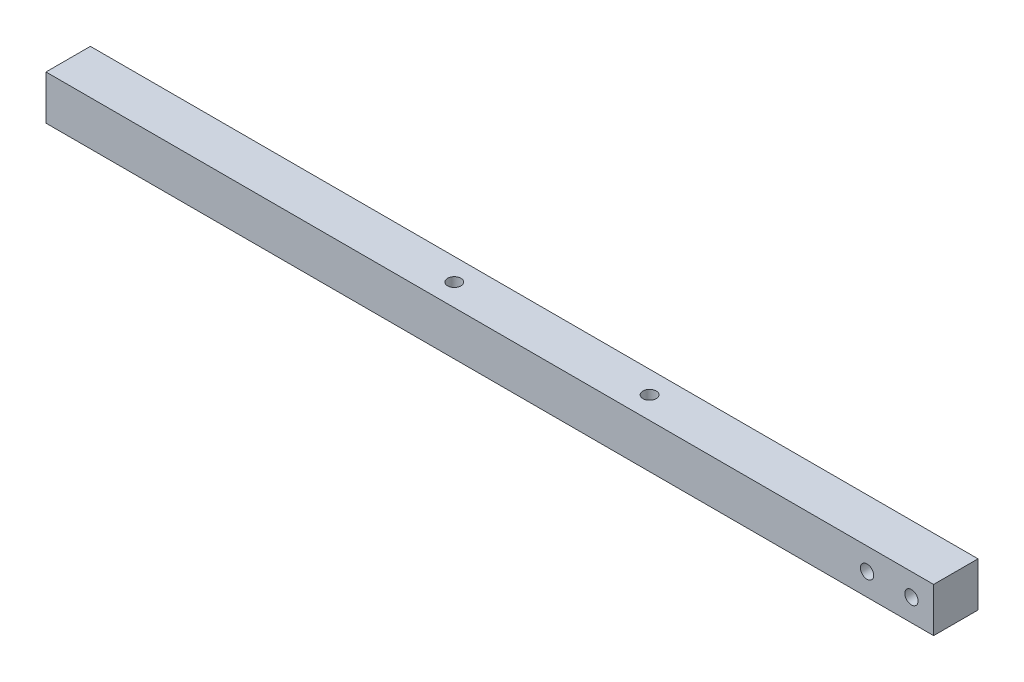
from build123d import *

# Parameters (mm, degrees)
SKIZZE1_W                       = 20
SKIZZE1_H                       = 20
AUFSATZ_LINEAR_AUSTRAGEN1_DEPTH = 400
SKIZZE2_R                       = 3
SCHNITT_LINEAR_AUSTRAGEN1_DEPTH = 401.62451248
SKETCH1_R                       = 3
EXTRUDE1_DEPTH                  = 401.62451248


with BuildPart() as part:
    # Skizze1 → Aufsatz-Linear austragen1 (new body)
    with BuildSketch(Plane(origin=(0, 0, 0), x_dir=(0, 0, -1), z_dir=(1, 0, 0))):
        Rectangle(SKIZZE1_W, SKIZZE1_H)
    extrude(amount=AUFSATZ_LINEAR_AUSTRAGEN1_DEPTH)

    # Skizze2 → Schnitt-Linear austragen1 (cut, through all)
    with BuildSketch(Plane(origin=(0, 10, 0), x_dir=(1, 0, 0), z_dir=(0, 1, 0))):
        with Locations(Location((174, 0, 0), (0, 0, 270))):
            Circle(SKIZZE2_R)
        with Locations(Location((262, 0, 0), (0, 0, 270))):
            Circle(SKIZZE2_R)
    extrude(amount=-SCHNITT_LINEAR_AUSTRAGEN1_DEPTH, mode=Mode.SUBTRACT)

    # Sketch1 → Extrude1 (cut, through all)
    with BuildSketch(Plane.XY.offset(10)):
        with Locations((390, 0)):
            Circle(SKETCH1_R)
        with Locations((370, 0)):
            Circle(SKETCH1_R)
    extrude(amount=-EXTRUDE1_DEPTH, mode=Mode.SUBTRACT)


solid = part.part
